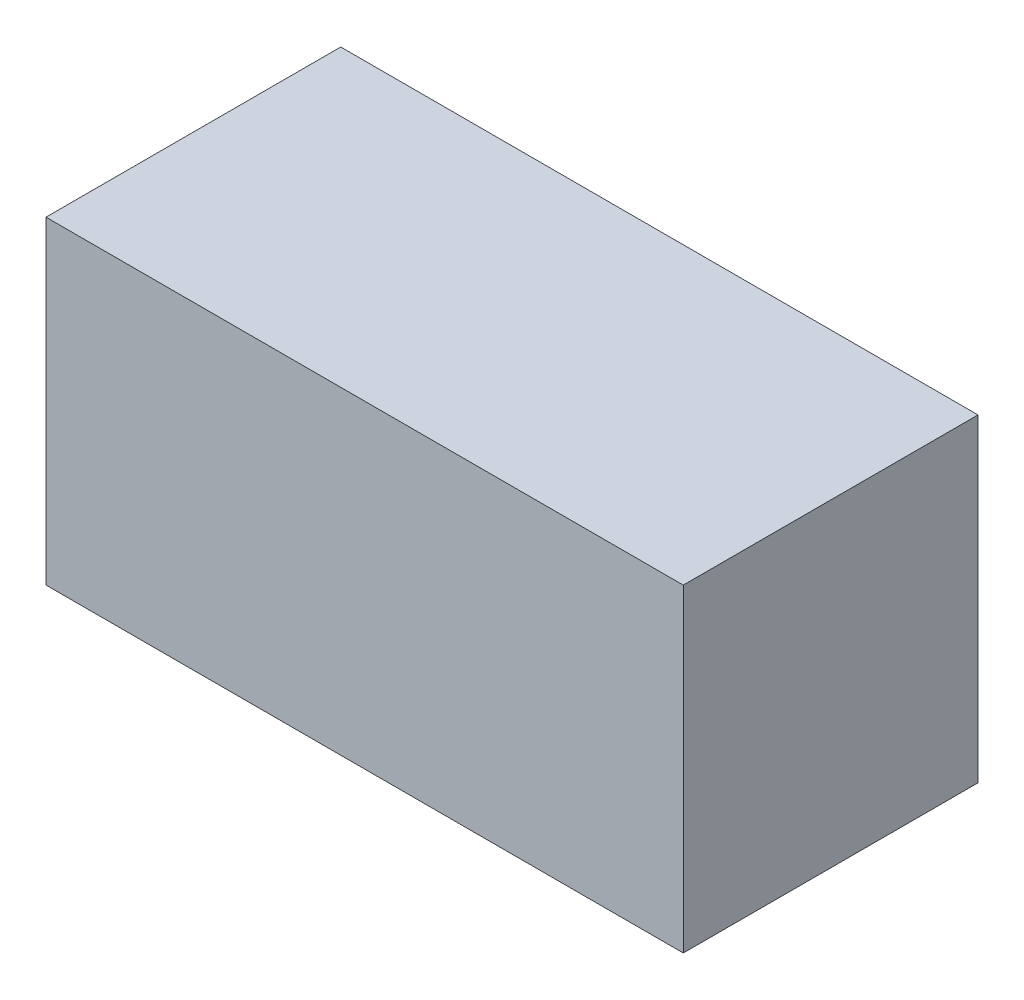
from build123d import *

# Parameters (mm, degrees)
SKETCH_1_W      = 800
SKETCH_1_H      = 400
EXTRUDE_1_DEPTH = 370


with BuildPart() as part:
    # Эскиз1 → Бобышка-Вытянуть1 (new body)
    with BuildSketch(Plane.XY):
        Rectangle(SKETCH_1_W, SKETCH_1_H)
    extrude(amount=EXTRUDE_1_DEPTH)


solid = part.part
